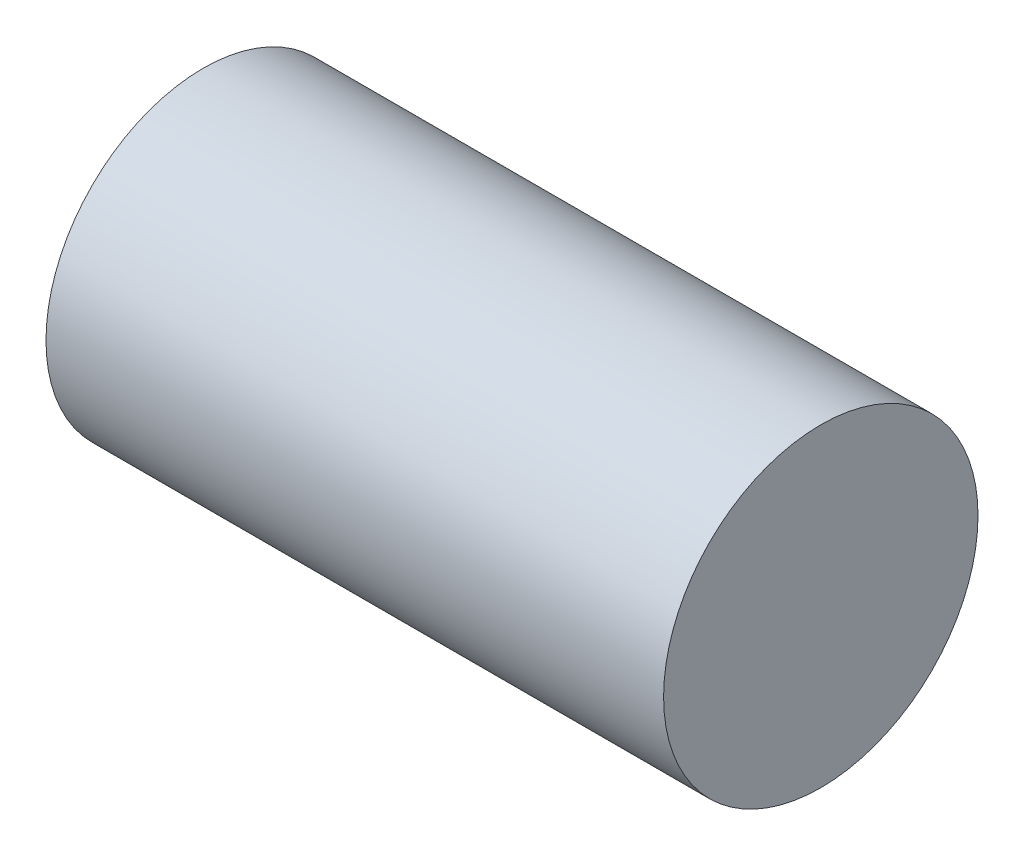
from build123d import *

# Parameters (mm, degrees)
HOSE_END_10_SKETCH_W = 55
HOSE_END_10_SKETCH_H = 14
SOCKET_1_SKETCH_W    = 23.9
SOCKET_1_SKETCH_H    = 6.35


with BuildPart() as part:
    # Hose_End_10 Sketch → Hose_End_10 (revolve)
    with BuildSketch(Plane.XY):
        with Locations((27.5, 7)):
            Rectangle(HOSE_END_10_SKETCH_W, HOSE_END_10_SKETCH_H)
    revolve(axis=Axis((-1000, 0, 0), (1, 0, 0)))

    # Socket 1 Sketch → Socket 1 (revolve, cut)
    with BuildSketch(Plane.XY):
        with Locations((10.95, 3.175)):
            Rectangle(SOCKET_1_SKETCH_W, SOCKET_1_SKETCH_H)
    revolve(axis=Axis((-1000, 0, 0), (1, 0, 0)), mode=Mode.SUBTRACT)


solid = part.part
